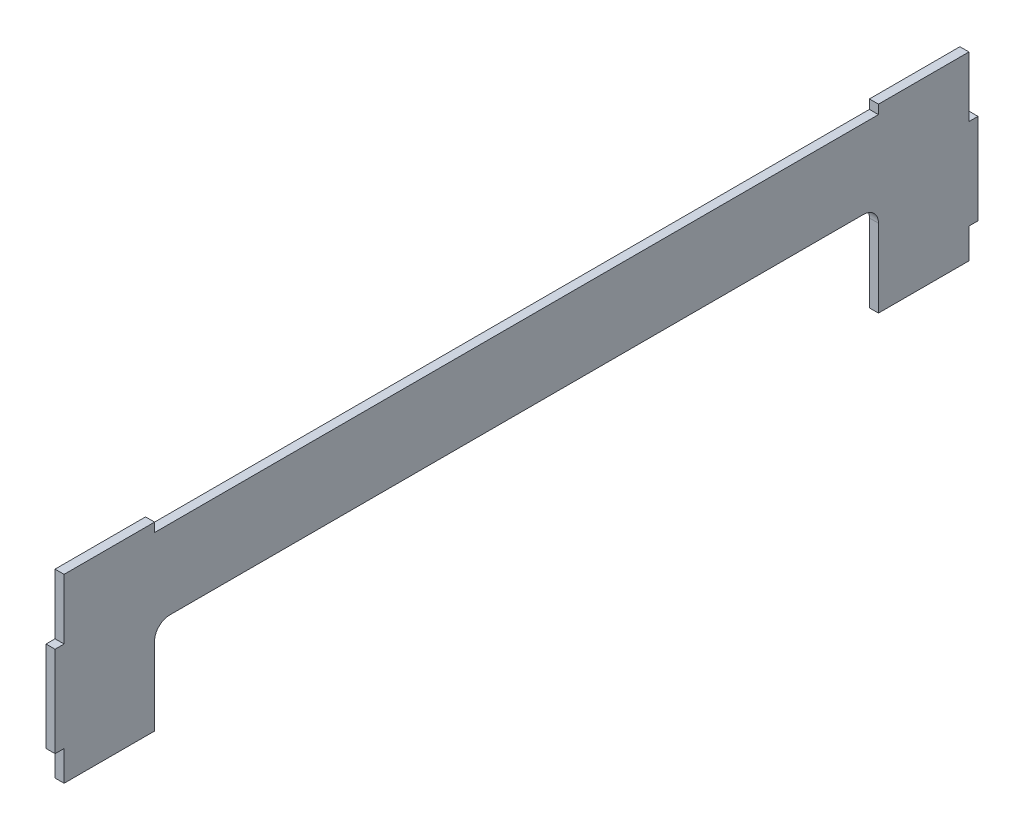
from build123d import *

# Parameters (mm, degrees)
BOSS_EXTRUDE1_DEPTH     = 3
CUT_EXTRUDE2_DEPTH      = 180.232477503
CUT_EXTRUDE2_DEPTH_BACK = 3


with BuildPart() as part:
    # Sketch1 → Boss-Extrude1 (new body)
    with BuildSketch(Plane(origin=(0, 0, 0), x_dir=(0, 0, -1), z_dir=(1, 0, 0))):
        Polygon((-169.090909091, 50), (-139.090909091, 50), (-139.090909091, 47), (100.909090909, 47), (100.909090909, 50), (130.909090909, 50), (130.909090909, 30), (133.909090909, 30), (133.909090909, 0), (130.909090909, 0), (130.909090909, -10), (-169.090909091, -10), (-169.090909091, 0), (-172.090909091, 0), (-172.090909091, 30), (-169.090909091, 30), align=None)
    extrude(amount=BOSS_EXTRUDE1_DEPTH)

    # Sketch2 → Cut-Extrude2 (cut, two sides: drawn at the far end of the back side and taken through both)
    with BuildSketch(Plane.ZY.offset(-CUT_EXTRUDE2_DEPTH_BACK)):
        with BuildLine():
            Line((-100.909090909, -579.031305027), (-100.909090909, -10))
            Line((-100.909090909, -10), (-100.909090909, 15.818953756))
            ThreePointArc((-100.909090909, 15.818953756), (-99.444624815, 19.354487662), (-95.909090909, 20.818953756))
            Line((-95.909090909, 20.818953756), (134.090909091, 20.818953756))
            ThreePointArc((134.090909091, 20.818953756), (137.626442997, 19.354487662), (139.090909091, 15.818953756))
            Line((139.090909091, 15.818953756), (139.090909091, -10))
            Line((139.090909091, -10), (139.090909091, -579.031305027))
            Line((139.090909091, -579.031305027), (139.090909091, -1717.09391508))
            Line((139.090909091, -1717.09391508), (-100.909090909, -1717.09391508))
            Line((-100.909090909, -1717.09391508), (-100.909090909, -579.031305027))
        make_face()
    extrude(amount=CUT_EXTRUDE2_DEPTH + CUT_EXTRUDE2_DEPTH_BACK, mode=Mode.SUBTRACT)


solid = part.part
